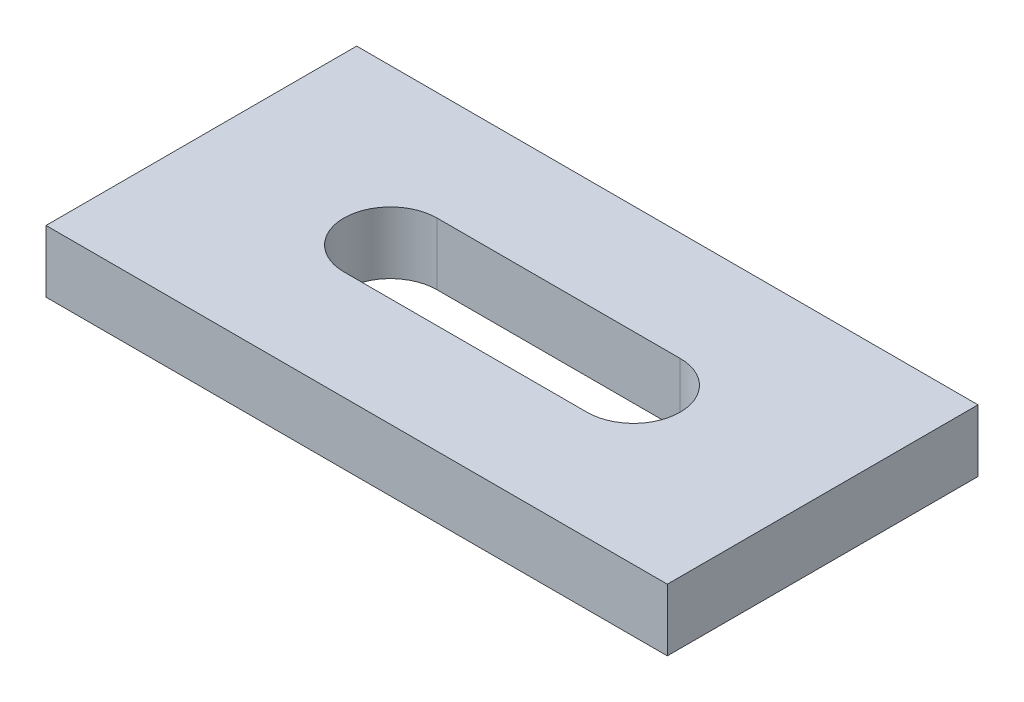
from build123d import *

# Parameters (mm, degrees)
SKETCH2_W           = 200
SKETCH2_H           = 100
BOSS_EXTRUDE2_DEPTH = 20


with BuildPart() as part:
    # Sketch2 → Boss-Extrude2 (new body)
    with BuildSketch(Plane(origin=(0, 0, 0), x_dir=(1, 0, 0), z_dir=(0, 1, 0))):
        Rectangle(SKETCH2_W, SKETCH2_H)
        with BuildLine():
            Line((-39.130434783, 15), (39.130434783, 15))
            ThreePointArc((39.130434783, 15), (54.130434783, 0), (39.130434783, -15))
            Line((39.130434783, -15), (-39.130434783, -15))
            ThreePointArc((-39.130434783, -15), (-54.130434783, 0), (-39.130434783, 15))
        make_face(mode=Mode.SUBTRACT)
    extrude(amount=BOSS_EXTRUDE2_DEPTH)


solid = part.part
